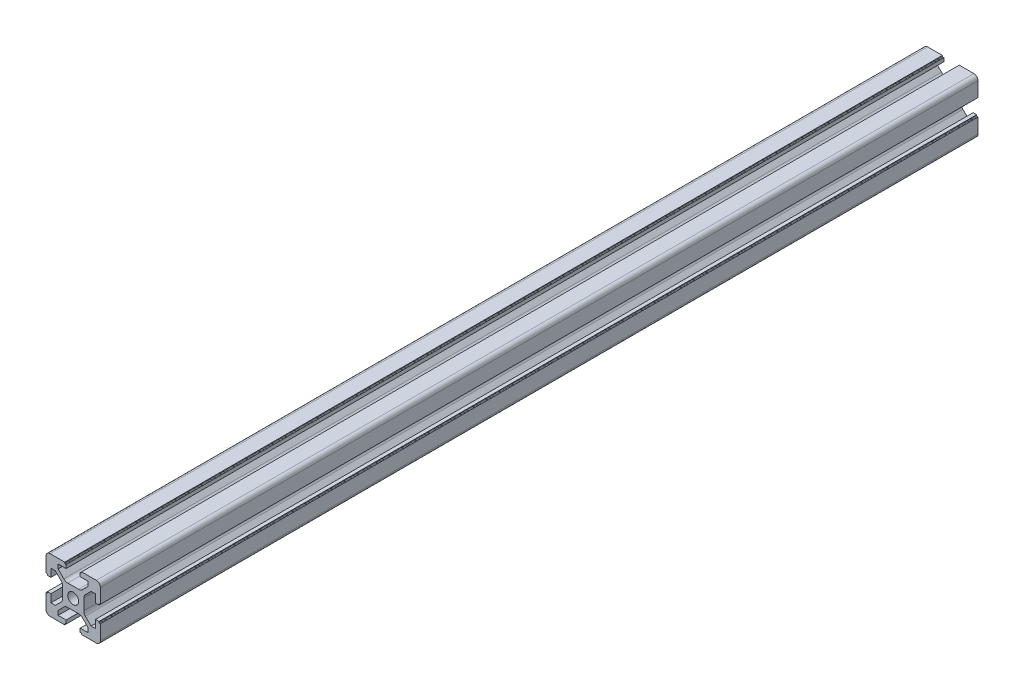
from build123d import *

# Parameters (mm, degrees)
SKETCH1_R      = 2
EXTRUDE1_DEPTH = 323


with BuildPart() as part:
    # Sketch1 → Extrude1 (new body)
    with BuildSketch(Plane.XY):
        with BuildLine():
            Line((0, 3.9), (-2.010912703, 3.9))
            ThreePointArc((-2.010912703, 3.9), (-2.776279568, 4.052240935), (-3.425126266, 4.485786438))
            Line((-3.425126266, 4.485786438), (-5.539339828, 6.6))
            Line((-5.539339828, 6.6), (-5.539339828, 8.2))
            Line((-5.539339828, 8.2), (-2.6, 8.2))
            Line((-2.6, 8.2), (-2.6, 9.5))
            Line((-2.6, 9.5), (-2.9, 9.5))
            ThreePointArc((-2.9, 9.5), (-3.041421356, 9.558578644), (-3.1, 9.7))
            Line((-3.1, 9.7), (-3.1, 10))
            Line((-3.1, 10), (-8.5, 10))
            ThreePointArc((-8.5, 10), (-9.560660172, 9.560660172), (-10, 8.5))
            Line((-10, 8.5), (-10, 3.1))
            Line((-10, 3.1), (-9.7, 3.1))
            ThreePointArc((-9.7, 3.1), (-9.558578644, 3.041421356), (-9.5, 2.9))
            Line((-9.5, 2.9), (-9.5, 2.6))
            Line((-9.5, 2.6), (-8.2, 2.6))
            Line((-8.2, 2.6), (-8.2, 5.539339828))
            Line((-8.2, 5.539339828), (-6.6, 5.539339828))
            Line((-6.6, 5.539339828), (-4.485786438, 3.425126266))
            ThreePointArc((-4.485786438, 3.425126266), (-4.052240935, 2.776279568), (-3.9, 2.010912703))
            Line((-3.9, 2.010912703), (-3.9, 0))
            Line((-3.9, 0), (-3.9, -2.010912703))
            ThreePointArc((-3.9, -2.010912703), (-4.052240935, -2.776279568), (-4.485786438, -3.425126266))
            Line((-4.485786438, -3.425126266), (-6.6, -5.539339828))
            Line((-6.6, -5.539339828), (-8.2, -5.539339828))
            Line((-8.2, -5.539339828), (-8.2, -2.6))
            Line((-8.2, -2.6), (-9.5, -2.6))
            Line((-9.5, -2.6), (-9.5, -2.9))
            ThreePointArc((-9.5, -2.9), (-9.558578644, -3.041421356), (-9.7, -3.1))
            Line((-9.7, -3.1), (-10, -3.1))
            Line((-10, -3.1), (-10, -8.5))
            ThreePointArc((-10, -8.5), (-9.560660172, -9.560660172), (-8.5, -10))
            Line((-8.5, -10), (-3.1, -10))
            Line((-3.1, -10), (-3.1, -9.7))
            ThreePointArc((-3.1, -9.7), (-3.041421356, -9.558578644), (-2.9, -9.5))
            Line((-2.9, -9.5), (-2.6, -9.5))
            Line((-2.6, -9.5), (-2.6, -8.2))
            Line((-2.6, -8.2), (-5.539339828, -8.2))
            Line((-5.539339828, -8.2), (-5.539339828, -6.6))
            Line((-5.539339828, -6.6), (-3.425126266, -4.485786438))
            ThreePointArc((-3.425126266, -4.485786438), (-2.776279568, -4.052240935), (-2.010912703, -3.9))
            Line((-2.010912703, -3.9), (0, -3.9))
            Line((0, -3.9), (2.010912703, -3.9))
            ThreePointArc((2.010912703, -3.9), (2.776279568, -4.052240935), (3.425126266, -4.485786438))
            Line((3.425126266, -4.485786438), (5.539339828, -6.6))
            Line((5.539339828, -6.6), (5.539339828, -8.2))
            Line((5.539339828, -8.2), (2.6, -8.2))
            Line((2.6, -8.2), (2.6, -9.5))
            Line((2.6, -9.5), (2.9, -9.5))
            ThreePointArc((2.9, -9.5), (3.041421356, -9.558578644), (3.1, -9.7))
            Line((3.1, -9.7), (3.1, -10))
            Line((3.1, -10), (8.5, -10))
            ThreePointArc((8.5, -10), (9.560660172, -9.560660172), (10, -8.5))
            Line((10, -8.5), (10, -3.1))
            Line((10, -3.1), (9.7, -3.1))
            ThreePointArc((9.7, -3.1), (9.558578644, -3.041421356), (9.5, -2.9))
            Line((9.5, -2.9), (9.5, -2.6))
            Line((9.5, -2.6), (8.2, -2.6))
            Line((8.2, -2.6), (8.2, -5.539339828))
            Line((8.2, -5.539339828), (6.6, -5.539339828))
            Line((6.6, -5.539339828), (4.485786438, -3.425126266))
            ThreePointArc((4.485786438, -3.425126266), (4.052240935, -2.776279568), (3.9, -2.010912703))
            Line((3.9, -2.010912703), (3.9, 0))
            Line((3.9, 0), (3.9, 2.010912703))
            ThreePointArc((3.9, 2.010912703), (4.052240935, 2.776279568), (4.485786438, 3.425126266))
            Line((4.485786438, 3.425126266), (6.6, 5.539339828))
            Line((6.6, 5.539339828), (8.2, 5.539339828))
            Line((8.2, 5.539339828), (8.2, 2.6))
            Line((8.2, 2.6), (9.5, 2.6))
            Line((9.5, 2.6), (9.5, 2.9))
            ThreePointArc((9.5, 2.9), (9.558578644, 3.041421356), (9.7, 3.1))
            Line((9.7, 3.1), (10, 3.1))
            Line((10, 3.1), (10, 8.5))
            ThreePointArc((10, 8.5), (9.560660172, 9.560660172), (8.5, 10))
            Line((8.5, 10), (3.1, 10))
            Line((3.1, 10), (3.1, 9.7))
            ThreePointArc((3.1, 9.7), (3.041421356, 9.558578644), (2.9, 9.5))
            Line((2.9, 9.5), (2.6, 9.5))
            Line((2.6, 9.5), (2.6, 8.2))
            Line((2.6, 8.2), (5.539339828, 8.2))
            Line((5.539339828, 8.2), (5.539339828, 6.6))
            Line((5.539339828, 6.6), (3.425126266, 4.485786438))
            ThreePointArc((3.425126266, 4.485786438), (2.776279568, 4.052240935), (2.010912703, 3.9))
            Line((2.010912703, 3.9), (0, 3.9))
        make_face()
        Circle(SKETCH1_R, mode=Mode.SUBTRACT)
    extrude(amount=EXTRUDE1_DEPTH)


solid = part.part
